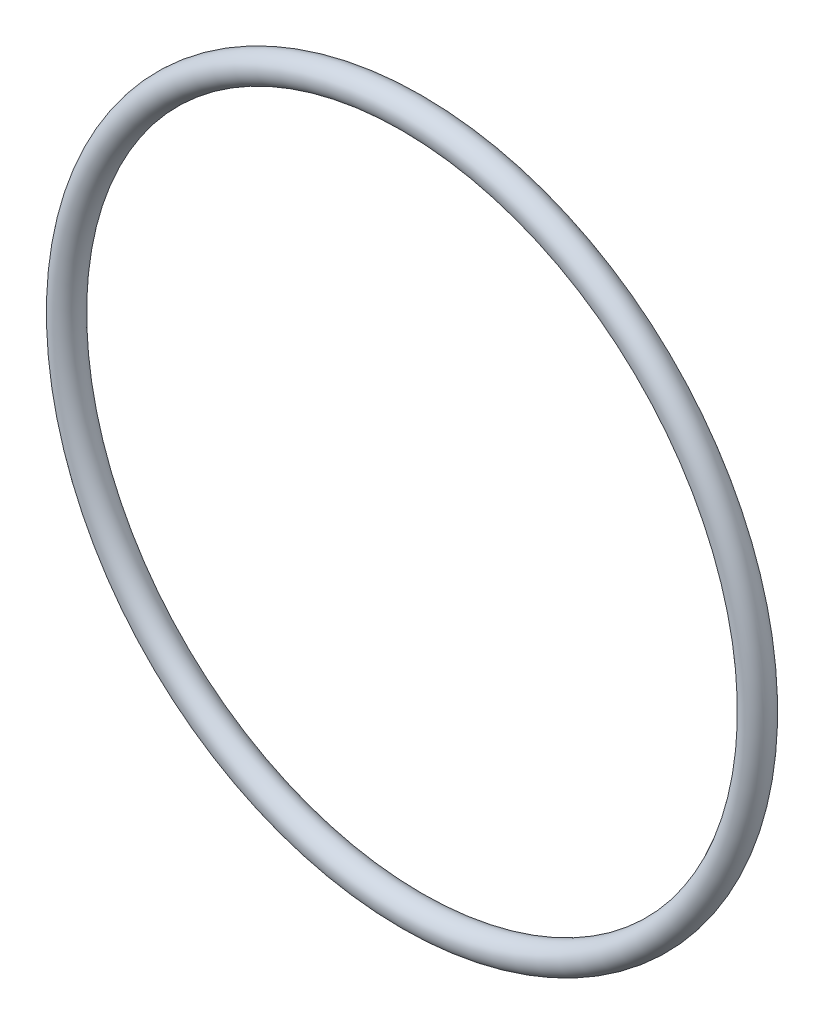
from build123d import *

# Parameters (mm, degrees)
SKETCH2_R = 1.7653


with BuildPart() as part:
    # Sketch2 → Revolve1 (revolve)
    with BuildSketch(Plane(origin=(0, 0, 0), x_dir=(0, 0, -1), z_dir=(1, 0, 0)), mode=Mode.PRIVATE) as revolve1_sk:
        with Locations((0, 42.8371)):
            Circle(SKETCH2_R)
    revolve(revolve1_sk.sketch.rotate(Axis((0, 0, 41.0718), (0, 0, -1)), 180), axis=Axis((0, 0, 41.0718), (0, 0, -1)))


solid = part.part
